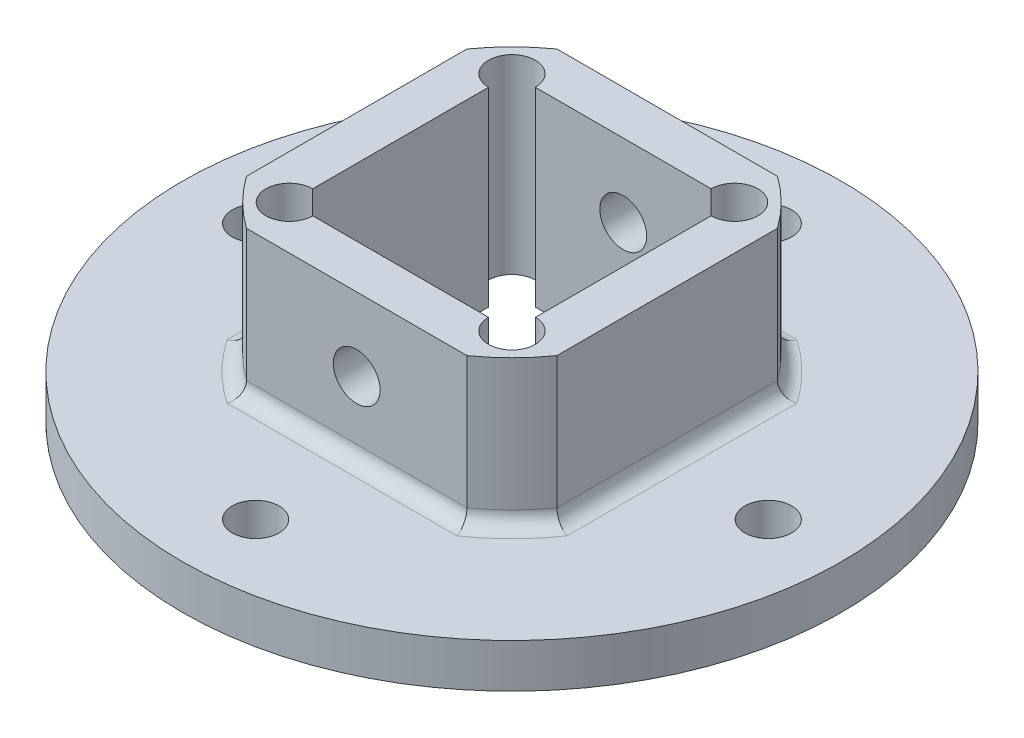
from build123d import *

# Parameters (mm, degrees)
SKETCH_1_R          = 22.5
SKETCH_1_R_2        = 1.6
SKETCH_1_W          = 15.2
SKETCH_1_H          = 15.2
EXTRUDE_1_DEPTH     = 3
SKETCH_2_W          = 15.2
SKETCH_2_H          = 15.2
EXTRUDE_2_DEPTH     = 10
FILLET_1_R          = 1
SKETCH_4_R          = 1.6
CUT_EXTRUDE_2_DEPTH = 35.372954485
SKETCH_3_R          = 1.6
CUT_EXTRUDE_4_DEPTH = 43.081587423


with BuildPart() as part:
    # 草图1 → 凸台-拉伸1 (new body)
    with BuildSketch(Plane(origin=(0, 0, 0), x_dir=(1, 0, 0), z_dir=(0, 1, 0))):
        with Locations(Location((0, 0, 0), (0, 0, 270))):
            Circle(SKETCH_1_R)
        with Locations(Location((0, 17.5, 0), (0, 0, 270))):
            Circle(SKETCH_1_R_2, mode=Mode.SUBTRACT)
        with Locations(Location((17.5, 0, 0), (0, 0, 270))):
            Circle(SKETCH_1_R_2, mode=Mode.SUBTRACT)
        with Locations(Location((0, -17.5, 0), (0, 0, 270))):
            Circle(SKETCH_1_R_2, mode=Mode.SUBTRACT)
        with Locations(Location((-17.5, 0, 0), (0, 0, 270))):
            Circle(SKETCH_1_R_2, mode=Mode.SUBTRACT)
        Rectangle(SKETCH_1_W, SKETCH_1_H, mode=Mode.SUBTRACT)
    extrude(amount=EXTRUDE_1_DEPTH)

    # 草图2 → 凸台-拉伸2 (add)
    with BuildSketch(Plane(origin=(0, 3, 0), x_dir=(1, 0, 0), z_dir=(0, 1, 0))):
        with BuildLine():
            Line((-10.6, -7.525955089), (-10.6, 7.525955089))
            ThreePointArc((-10.6, 7.525955089), (-9.192388155, 9.192388155), (-7.525955089, 10.6))
            Line((-7.525955089, 10.6), (7.525955089, 10.6))
            ThreePointArc((7.525955089, 10.6), (9.192388155, 9.192388155), (10.6, 7.525955089))
            Line((10.6, 7.525955089), (10.6, -7.525955089))
            ThreePointArc((10.6, -7.525955089), (9.192388155, -9.192388155), (7.525955089, -10.6))
            Line((7.525955089, -10.6), (-7.525955089, -10.6))
            ThreePointArc((-7.525955089, -10.6), (-9.192388155, -9.192388155), (-10.6, -7.525955089))
        make_face()
        Rectangle(SKETCH_2_W, SKETCH_2_H, mode=Mode.SUBTRACT)
    extrude(amount=EXTRUDE_2_DEPTH)

    # 圆角1
    fillet_1_edges = [part.edges().sort_by_distance(p)[0] for p in [
        (9.192388155, 3, 9.192388155),
        (10.6, 3, 0),
        (9.192388155, 3, -9.192388155),
        (0, 3, -10.6),
        (-9.192388155, 3, -9.192388155),
        (-10.6, 3, 0),
        (-9.192388155, 3, 9.192388155),
        (0, 3, 10.6),
    ]]
    fillet(fillet_1_edges, radius=FILLET_1_R)

    # 草图4 → 切除-拉伸2 (cut, through all)
    with BuildSketch(Plane(origin=(0, 13, 0), x_dir=(1, 0, 0), z_dir=(0, 1, 0))):
        with Locations((7.6, 7.6)):
            Circle(SKETCH_4_R)
        with Locations((7.6, -7.6)):
            Circle(SKETCH_4_R)
        with Locations((-7.6, -7.6)):
            Circle(SKETCH_4_R)
        with Locations((-7.6, 7.6)):
            Circle(SKETCH_4_R)
    extrude(amount=-CUT_EXTRUDE_2_DEPTH, mode=Mode.SUBTRACT)

    # 草图3 → 切除-拉伸4 (cut, through all)
    with BuildSketch(Plane(origin=(0, 0, -10.6), x_dir=(-1, 0, 0), z_dir=(0, 0, -1))):
        with Locations((0, 8)):
            Circle(SKETCH_3_R)
    extrude(amount=-CUT_EXTRUDE_4_DEPTH, mode=Mode.SUBTRACT)


solid = part.part
